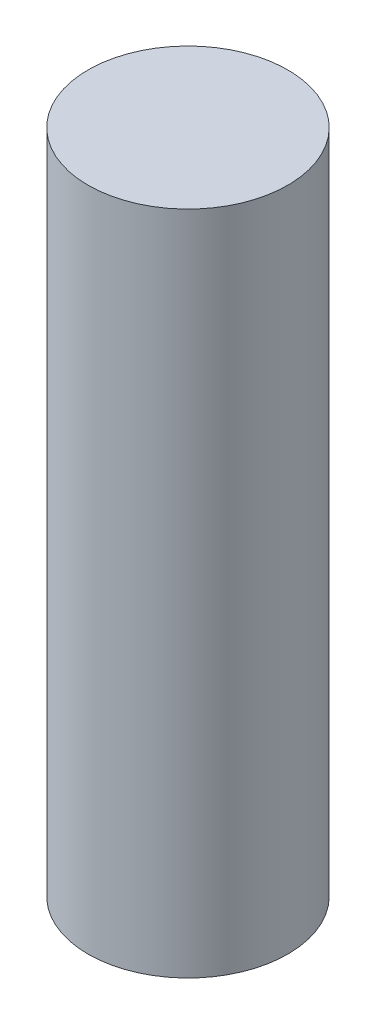
from build123d import *

# Parameters (mm, degrees)
SKETCH_1_R      = 150
EXTRUDE_1_DEPTH = 1000


with BuildPart() as part:
    # 草图1 → 凸台-拉伸1 (new body)
    with BuildSketch(Plane(origin=(0, 0, 0), x_dir=(1, 0, 0), z_dir=(0, 1, 0))):
        with Locations(Location((0, 0, 0), (0, 0, 270))):
            Circle(SKETCH_1_R)
    extrude(amount=EXTRUDE_1_DEPTH)


solid = part.part
